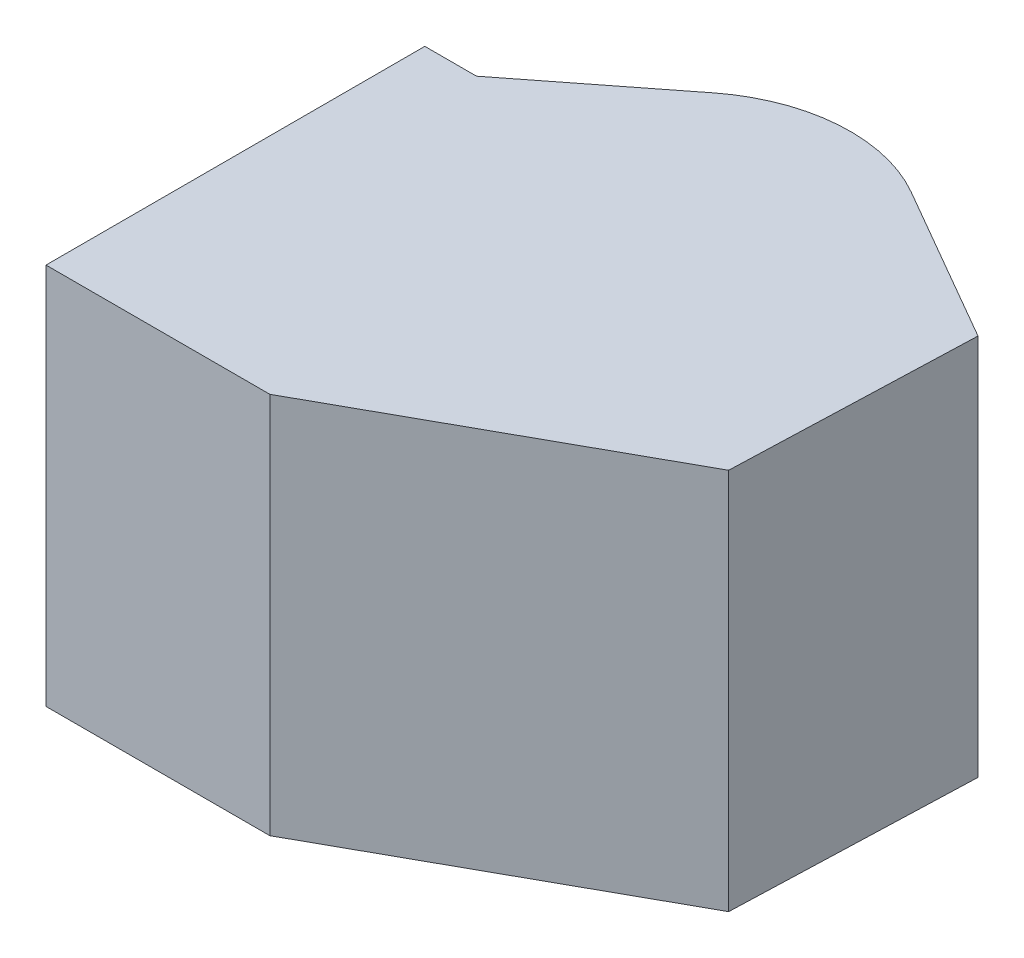
from build123d import *

# Parameters (mm, degrees)
BOSS_EXTRUDE1_DEPTH      = 55.5
BOSS_EXTRUDE1_DEPTH_BACK = 55.5
SKETCH2_R                = 45
BOSS_EXTRUDE2_DEPTH      = 10
FILLET1_R                = 3


with BuildPart() as part:
    # Sketch1 → Boss-Extrude1 (new, two sides: drawn at the far end of the back side and taken through both)
    with BuildSketch(Plane(origin=(0, 0, 0), x_dir=(1, 0, 0), z_dir=(0, 1, 0)).offset(-BOSS_EXTRUDE1_DEPTH_BACK)):
        with BuildLine():
            Line((0, 0), (65, 0))
            Line((65, 0), (150.7127313, 47.511342784))
            Line((150.7127313, 47.511342784), (153.155696069, 117.468700675))
            Line((153.155696069, 117.468700675), (107.256349668, 143.968700675))
            ThreePointArc((107.256349668, 143.968700675), (79.846161337, 150.2914933), (53.590163022, 140.196014935))
            Line((53.590163022, 140.196014935), (15, 110))
            Line((15, 110), (0, 110))
            Line((0, 110), (0, 0))
        make_face()
    extrude(amount=BOSS_EXTRUDE1_DEPTH + BOSS_EXTRUDE1_DEPTH_BACK)

    # Sketch2 → Boss-Extrude2 (add)
    with BuildSketch(Plane.ZY):
        with Locations((-55, 0)):
            Circle(SKETCH2_R)
    extrude(amount=BOSS_EXTRUDE2_DEPTH)

    # Fillet1
    fillet1_edges = [part.edges().sort_by_distance(p)[0] for p in [
        (0, 0, -100),
    ]]
    fillet(fillet1_edges, radius=FILLET1_R)


with BuildPart() as part_1:
    # Body-Move/Copy1: moved
    add(part.part.moved(Location((-83.217640918, 0, 55))))


solid = part_1.part
